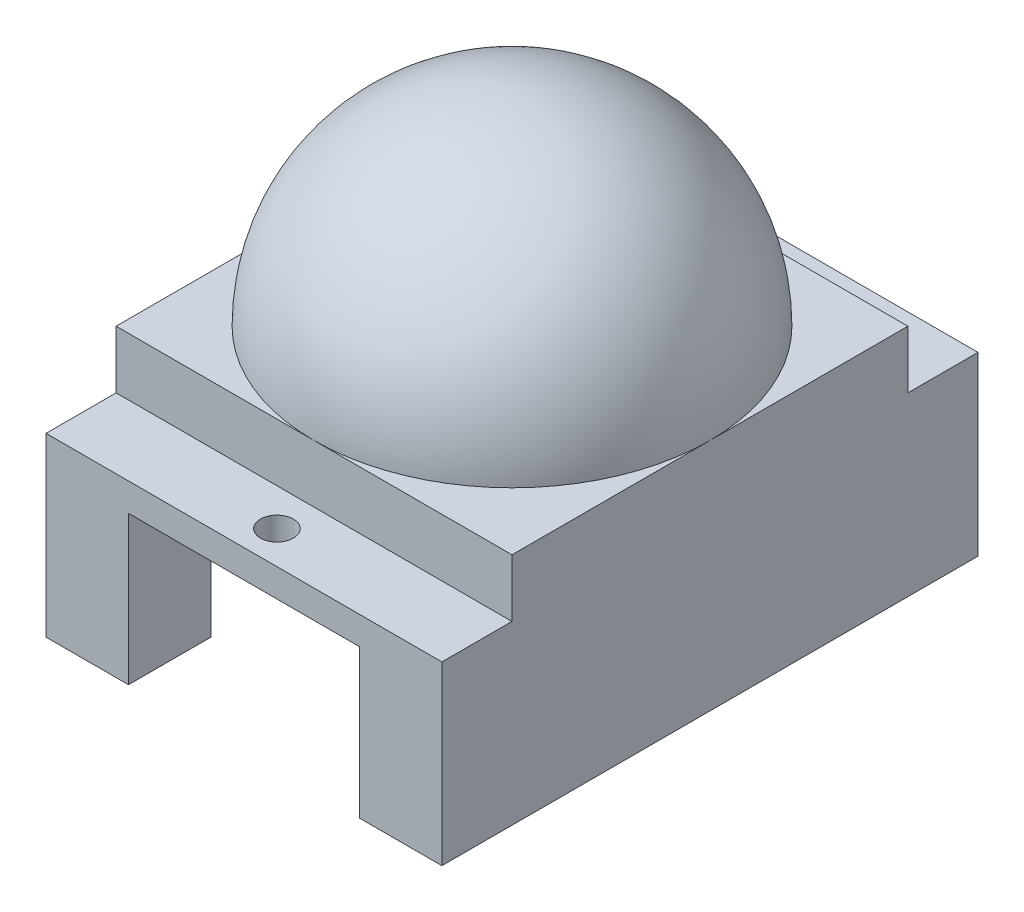
from build123d import *

# Parameters (mm, degrees)
SKETCH1_W           = 24
SKETCH1_H           = 32.5
SKETCH1_R           = 1
BOSS_EXTRUDE1_DEPTH = 1.7
SKETCH2_W           = 24
SKETCH2_H           = 24
BOSS_EXTRUDE2_DEPTH = 3.5
SKETCH4_W           = 5
SKETCH4_H           = 5
SKETCH4_H_2         = 8
BOSS_EXTRUDE3_DEPTH = 9


with BuildPart() as part:
    # Sketch1 → Boss-Extrude1 (new body)
    with BuildSketch(Plane(origin=(0, 0, 0), x_dir=(1, 0, 0), z_dir=(0, 1, 0))):
        Rectangle(SKETCH1_W, SKETCH1_H)
        with Locations(Location((0, 14.25, 0), (0, 0, 270))):
            Circle(SKETCH1_R, mode=Mode.SUBTRACT)
        with Locations(Location((0, -14.25, 0), (0, 0, 270))):
            Circle(SKETCH1_R, mode=Mode.SUBTRACT)
    extrude(amount=BOSS_EXTRUDE1_DEPTH)

    # Sketch2 → Boss-Extrude2 (add)
    with BuildSketch(Plane(origin=(0, 1.7, 0), x_dir=(1, 0, 0), z_dir=(0, 1, 0))):
        Rectangle(SKETCH2_W, SKETCH2_H)
    extrude(amount=BOSS_EXTRUDE2_DEPTH)

    # Sketch3 → Revolve1 (revolve)
    with BuildSketch(Plane.XY):
        with BuildLine():
            Line((0, 17.2), (0, 5.2))
            Line((0, 5.2), (12, 5.2))
            ThreePointArc((12, 5.2), (8.485281374, 13.685281374), (0, 17.2))
        make_face()
    revolve(axis=Axis((0, 17.2, 0), (0, -1, 0)))

    # Sketch4 → Boss-Extrude3 (add)
    with BuildSketch(Plane.XZ):
        Polygon((7, 16.25), (12, 16.25), (12, -16.25), (4, -16.25), (4, -12.75), (7, -12.75), align=None)
        with Locations((-9.5, 13.75)):
            Rectangle(SKETCH4_W, SKETCH4_H)
        with Locations((-9.5, -13.75)):
            Rectangle(SKETCH4_W, SKETCH4_H)
        with Locations((-9.5, 0)):
            Rectangle(SKETCH4_W, SKETCH4_H_2)
    extrude(amount=BOSS_EXTRUDE3_DEPTH)


solid = part.part
